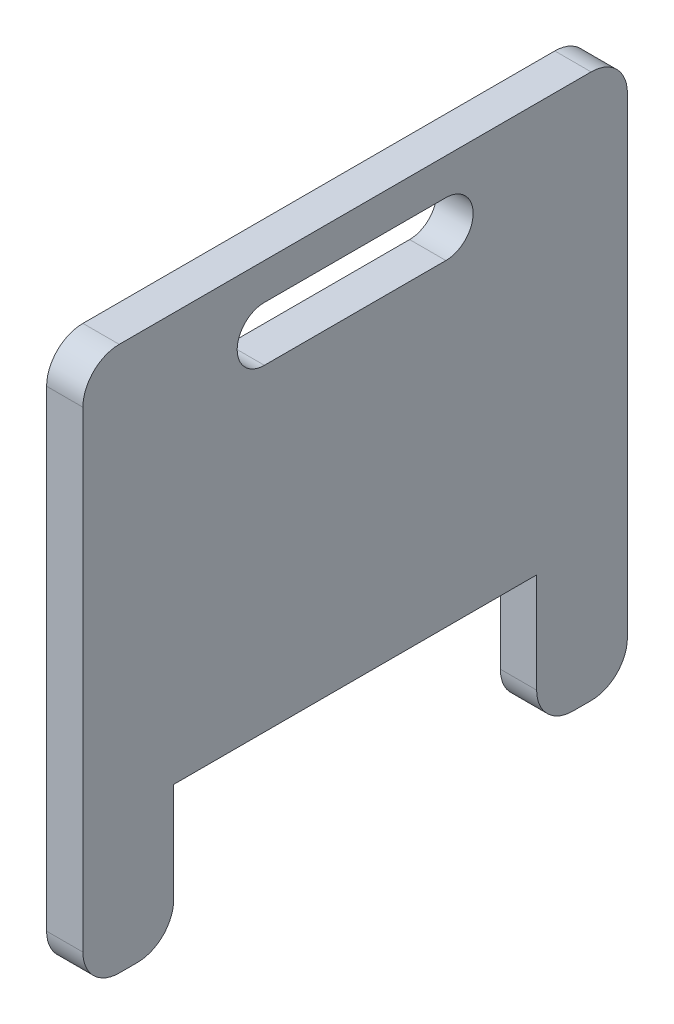
from build123d import *

# Parameters (mm, degrees)
SKETCH10_W          = 150
SKETCH10_H          = 150
BOSS_EXTRUDE3_DEPTH = 10
SKETCH12_W          = 100
SKETCH12_H          = 37.5
CUT_EXTRUDE2_DEPTH  = 10
FILLET7_R           = 10
CUT_EXTRUDE3_DEPTH  = 35


with BuildPart() as part:
    # Sketch10 → Boss-Extrude3 (new body)
    with BuildSketch(Plane(origin=(0, 0, 0), x_dir=(0, 0, -1), z_dir=(1, 0, 0))):
        with Locations((75, 112.5)):
            Rectangle(SKETCH10_W, SKETCH10_H)
    extrude(amount=BOSS_EXTRUDE3_DEPTH)

    # Sketch12 → Cut-Extrude2 (cut)
    with BuildSketch(Plane.ZY):
        with Locations((-75, 56.25)):
            Rectangle(SKETCH12_W, SKETCH12_H)
    extrude(amount=-CUT_EXTRUDE2_DEPTH, mode=Mode.SUBTRACT)

    # Fillet7
    fillet7_edges = [part.edges().sort_by_distance(p)[0] for p in [
        (5, 37.5, -125),
        (5, 37.5, -25),
        (5, 187.5, 0),
        (5, 187.5, -150),
        (5, 37.5, -150),
        (5, 37.5, 0),
    ]]
    fillet(fillet7_edges, radius=FILLET7_R)

    # Sketch13 → Cut-Extrude3 (cut)
    with BuildSketch(Plane(origin=(10, 0, 0), x_dir=(0, 0, -1), z_dir=(1, 0, 0))):
        with BuildLine():
            Line((50, 177.5), (100, 177.5))
            ThreePointArc((100, 177.5), (107.5, 170), (100, 162.5))
            Line((100, 162.5), (50, 162.5))
            ThreePointArc((50, 162.5), (42.5, 170), (50, 177.5))
        make_face()
    extrude(amount=-CUT_EXTRUDE3_DEPTH, mode=Mode.SUBTRACT)


solid = part.part
